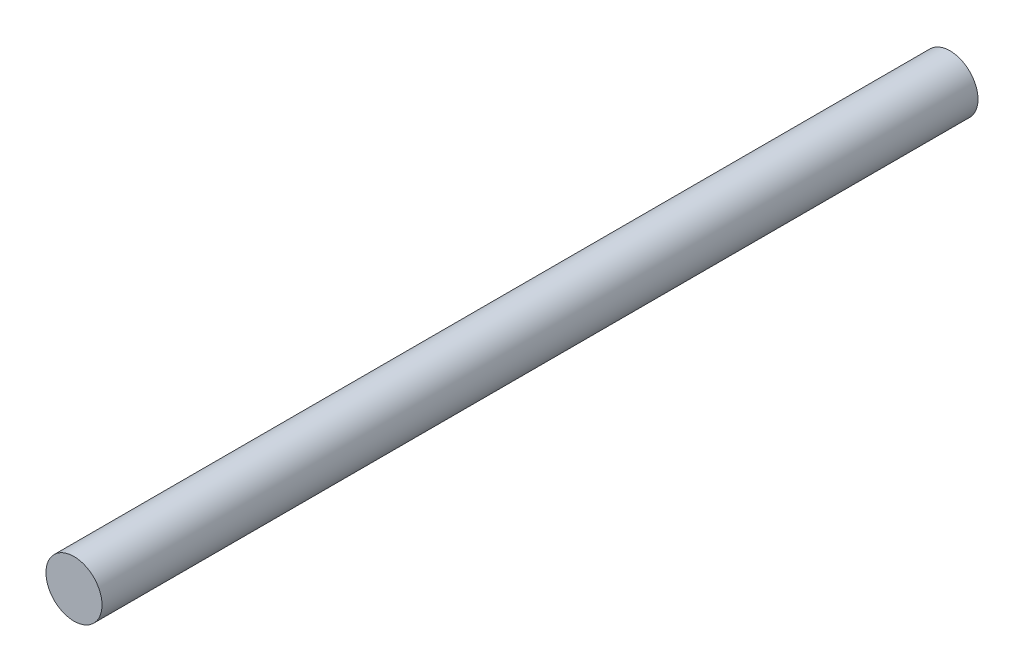
from build123d import *

# Parameters (mm, degrees)
SCHIZZO1_R                   = 1.6
ESTRUSIONE_ESTRUSIONE1_DEPTH = 50


with BuildPart() as part:
    # Schizzo1 → Estrusione-Estrusione1 (new body)
    with BuildSketch(Plane(origin=(0, 0, 0), x_dir=(0, 1, 0), z_dir=(0, 0, 1))):
        with Locations(Location((0, 0, 0), (0, 0, 270))):
            Circle(SCHIZZO1_R)
    extrude(amount=ESTRUSIONE_ESTRUSIONE1_DEPTH)


solid = part.part
